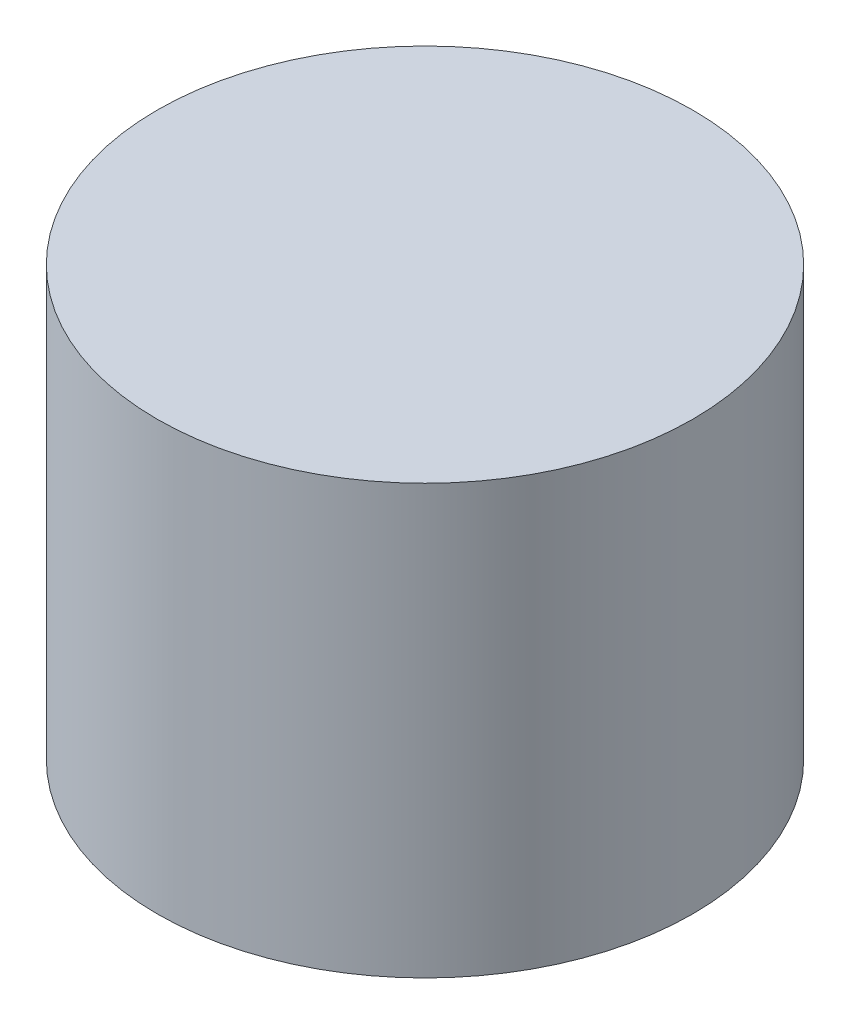
from build123d import *

# Parameters (mm, degrees)
ESQUISSE1_R        = 2.5
BOSS_EXTRU_1_DEPTH = 4


with BuildPart() as part:
    # Esquisse1 → Boss.-Extru.1 (new body)
    with BuildSketch(Plane(origin=(0, 0, 0), x_dir=(1, 0, 0), z_dir=(0, 1, 0))):
        with Locations(Location((0, 0, 0), (0, 0, 270))):
            Circle(ESQUISSE1_R)
    extrude(amount=BOSS_EXTRU_1_DEPTH)


solid = part.part
